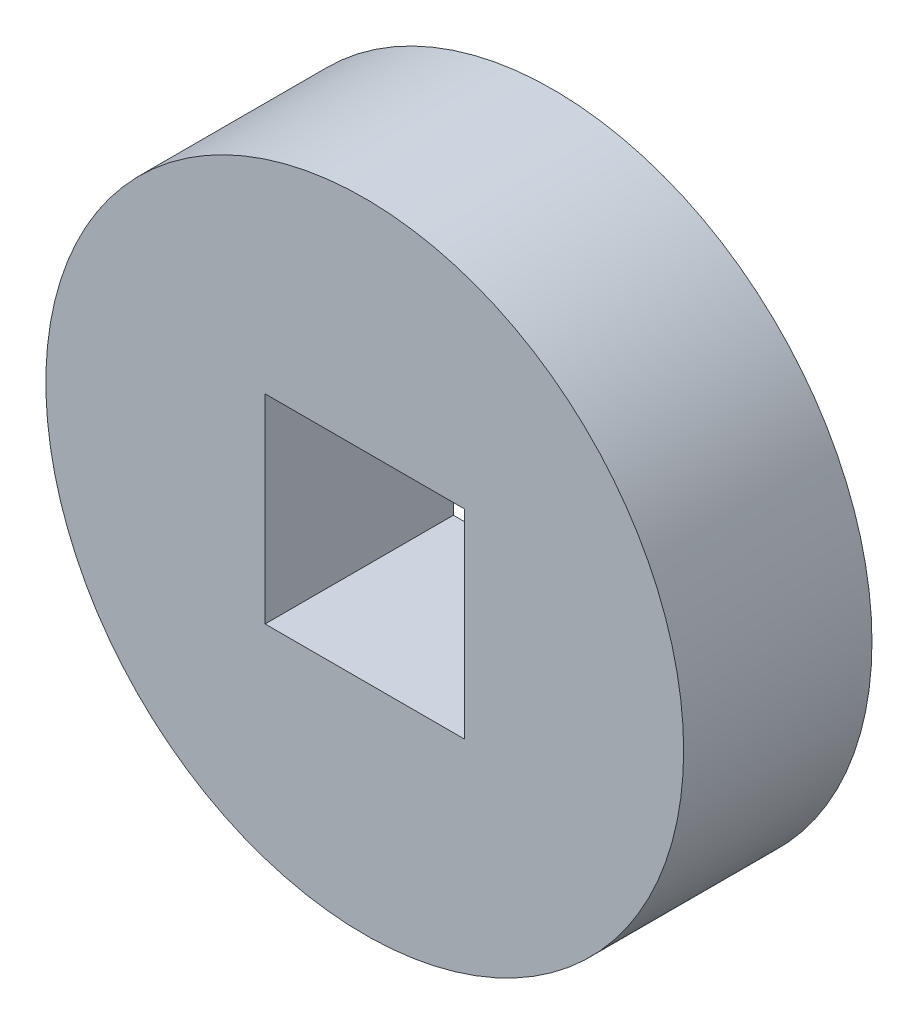
from build123d import *

# Parameters (mm, degrees)
SKETCH1_R           = 5.08
SKETCH1_W           = 3.175
SKETCH1_H           = 3.175
BOSS_EXTRUDE1_DEPTH = 3


with BuildPart() as part:
    # Sketch1 → Boss-Extrude1 (new body)
    with BuildSketch(Plane.XY):
        Circle(SKETCH1_R)
        Rectangle(SKETCH1_W, SKETCH1_H, mode=Mode.SUBTRACT)
    extrude(amount=BOSS_EXTRUDE1_DEPTH)


solid = part.part
